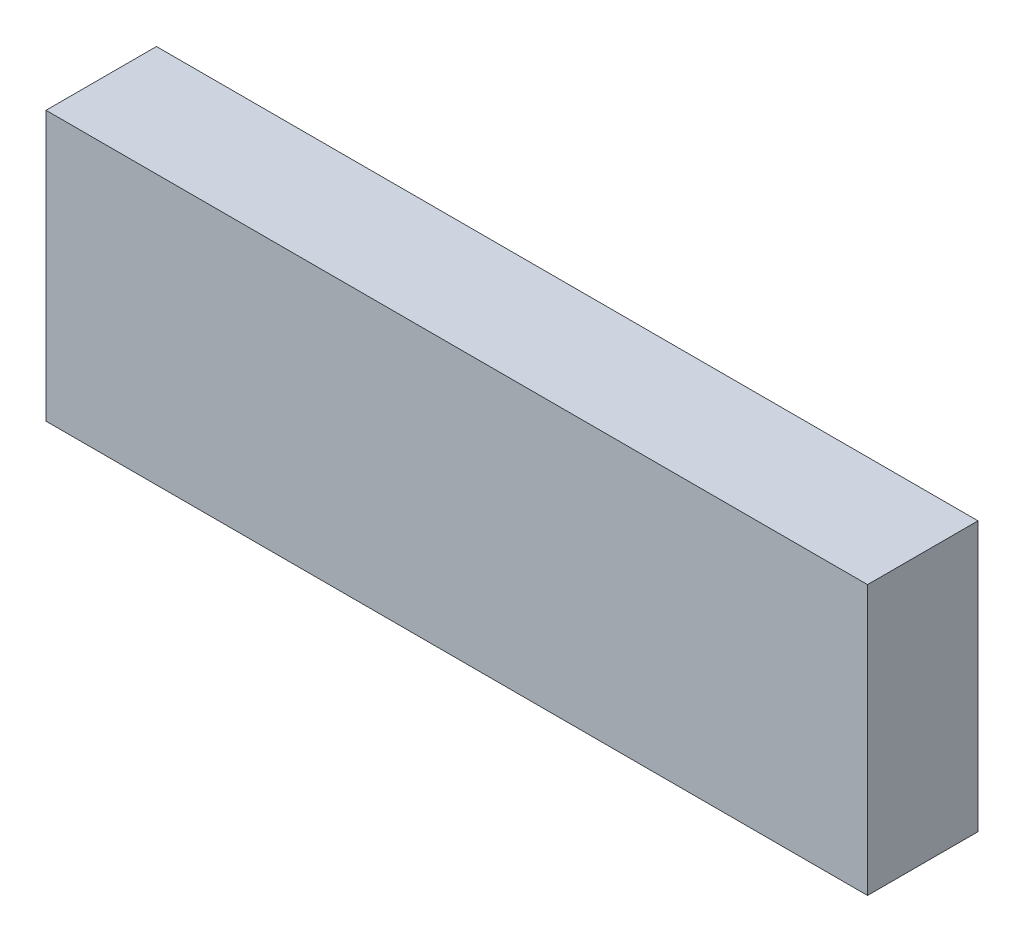
from build123d import *

# Parameters (mm, degrees)
SKETCH_1_W          = 23.8
SKETCH_1_H          = 7.8
EXTRUDE_1_DEPTH     = 3.2
SKETCH_2_R          = 2.5
CUT_EXTRUDE_1_DEPTH = 1.8


with BuildPart() as part:
    # Эскиз1 → Бобышка-Вытянуть1 (new body)
    with BuildSketch(Plane.XY):
        Rectangle(SKETCH_1_W, SKETCH_1_H)
    extrude(amount=EXTRUDE_1_DEPTH)

    # Эскиз2 → Вырез-Вытянуть1 (cut)
    with BuildSketch(Plane(origin=(0, 0, 0), x_dir=(-1, 0, 0), z_dir=(0, 0, -1))):
        Circle(SKETCH_2_R)
        with Locations((8, 0)):
            Circle(SKETCH_2_R)
        with Locations((-8, 0)):
            Circle(SKETCH_2_R)
    extrude(amount=-CUT_EXTRUDE_1_DEPTH, mode=Mode.SUBTRACT)


solid = part.part
